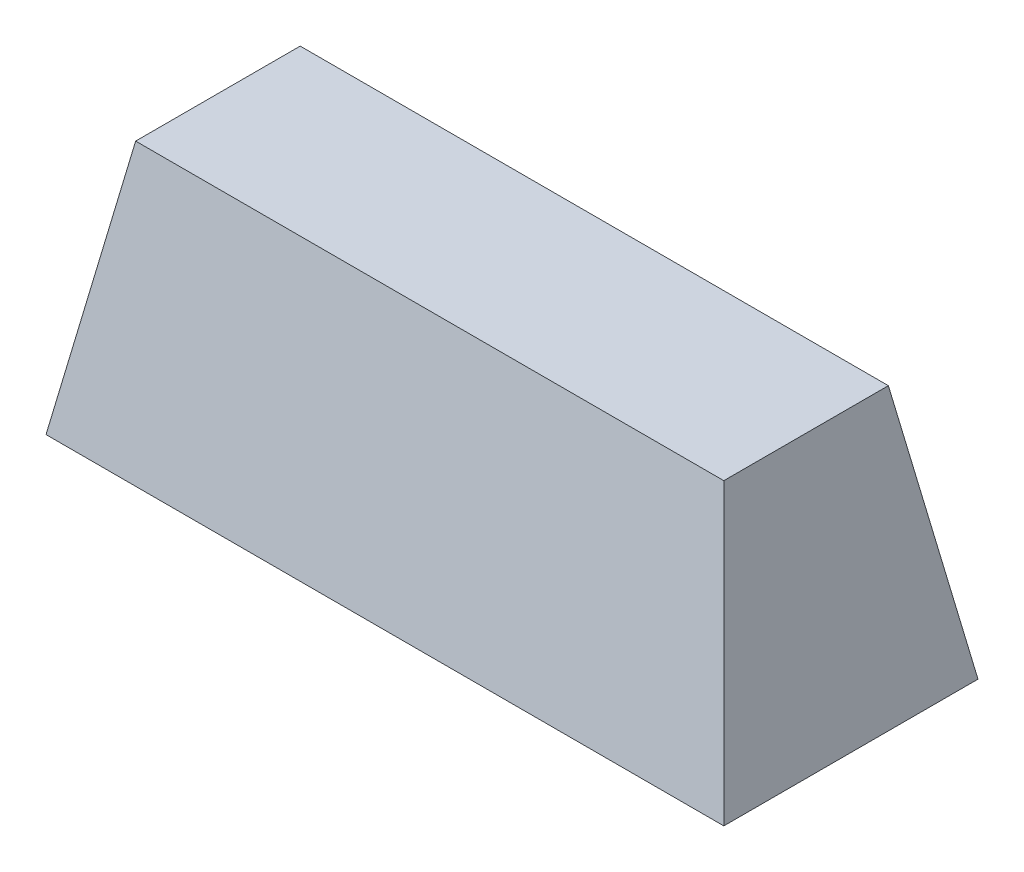
from build123d import *

# Parameters (mm, degrees)
SKETCH1_W           = 200
SKETCH1_H           = 75
BOSS_EXTRUDE1_DEPTH = 75
BOSS_EXTRUDE1_TAPER = 10


with BuildPart() as part:
    # Sketch1 → Boss-Extrude1 (new body)
    with BuildSketch(Plane(origin=(0, 0, 0), x_dir=(1, 0, 0), z_dir=(0, 1, 0))):
        Rectangle(SKETCH1_W, SKETCH1_H)
    extrude(amount=BOSS_EXTRUDE1_DEPTH, taper=BOSS_EXTRUDE1_TAPER)


solid = part.part
